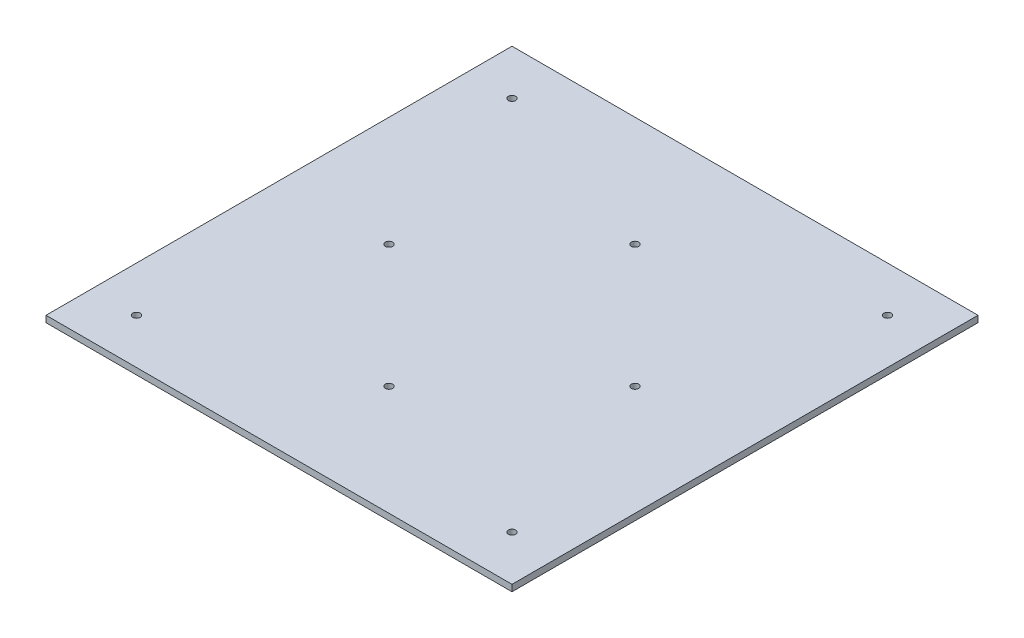
from build123d import *

# Parameters (mm, degrees)
SKETCH1_W                = 215.9
SKETCH1_H                = 215.9
BOSS_EXTRUDE1_DEPTH      = 1.5
M3_CLEARANCE_HOLE1_D     = 3.4
M3_CLEARANCE_HOLE1_DEPTH = 10
M3_CLEARANCE_HOLE1_TIP   = 1.021463052


with BuildPart() as part:
    # Sketch1 → Boss-Extrude1 (new, symmetric)
    with BuildSketch(Plane(origin=(0, 0, 0), x_dir=(1, 0, 0), z_dir=(0, 1, 0))):
        Rectangle(SKETCH1_W, SKETCH1_H)
    extrude(amount=BOSS_EXTRUDE1_DEPTH, both=True)

    # M3 Clearance Hole1
    with Locations(Plane(origin=(-87, 1.5, -87), x_dir=(0, 0, 1), z_dir=(0, 1, 0))):
        with Locations((0, 0), (30, 87), (0, 174), (87, 144), (174, 174), (144, 87), (174, 0), (87, 30)):
            Hole(M3_CLEARANCE_HOLE1_D / 2, depth=M3_CLEARANCE_HOLE1_DEPTH)
            with Locations((0, 0, -(M3_CLEARANCE_HOLE1_DEPTH + M3_CLEARANCE_HOLE1_TIP / 2))):  # 118° drill point
                Cone(0, M3_CLEARANCE_HOLE1_D / 2, M3_CLEARANCE_HOLE1_TIP, mode=Mode.SUBTRACT)


solid = part.part
